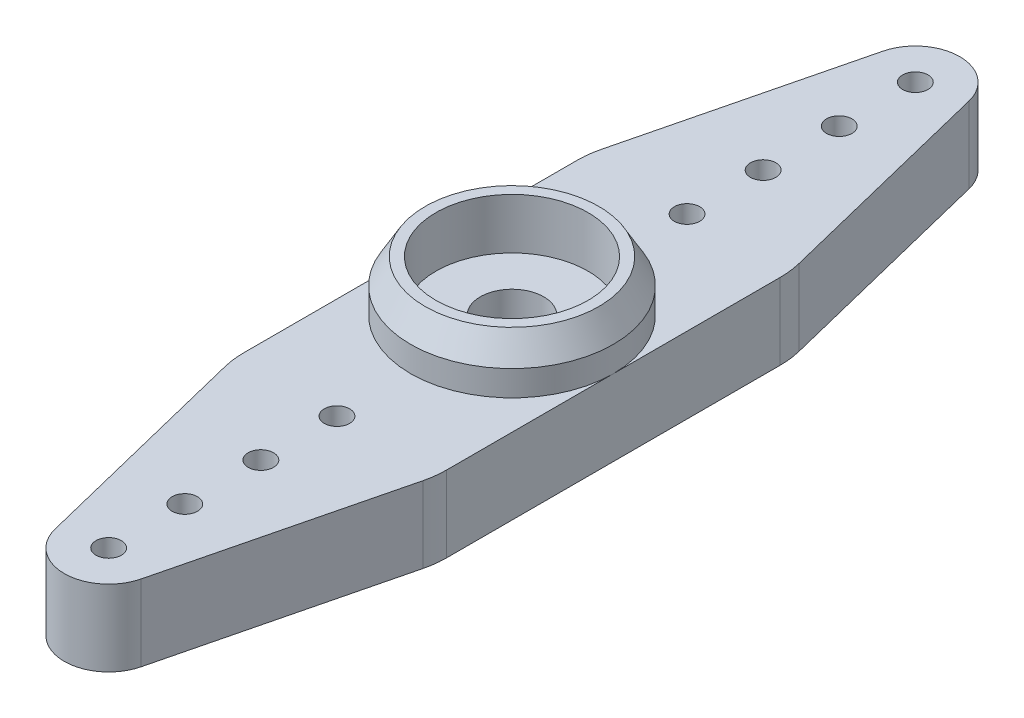
from build123d import *

# Parameters (mm, degrees)
CROQUIS1_R              = 0.5
SALIENTE_EXTRUIR1_DEPTH = 3
MATRIZC1_COUNT          = 2
CROQUIS2_R              = 4
CROQUIS2_R_2            = 3
SALIENTE_EXTRUIR2_DEPTH = 2
CHAFL_N1_SIZE           = 1
CHAFL_N1_SIZE2          = 0.577350269


with BuildPart() as part:
    # Croquis1 → Saliente-Extruir1 (new body)
    with BuildSketch(Plane(origin=(0, 0, 0), x_dir=(1, 0, 0), z_dir=(0, 1, 0))):
        with BuildLine():
            Line((-4, 0), (-4, 6.574293681))
            ThreePointArc((-4, 6.574293681), (-3.974394349, 6.996885575), (-3.897952052, 7.413294188))
            Line((-3.897952052, 7.413294188), (-1.698976026, 16.319147094))
            ThreePointArc((-1.698976026, 16.319147094), (0, 17.649646841), (1.698976026, 16.319147094))
            Line((1.698976026, 16.319147094), (3.897952052, 7.413294188))
            ThreePointArc((3.897952052, 7.413294188), (3.974394349, 6.996885575), (4, 6.574293681))
            Line((4, 6.574293681), (4, 0))
            Line((4, 0), (1.25, 0))
            ThreePointArc((1.25, 0), (0, 1.25), (-1.25, 0))
            Line((-1.25, 0), (-4, 0))
        make_face()
        with Locations(Location((0, 15.899646841, 0), (0, 0, 270))):
            Circle(CROQUIS1_R, mode=Mode.SUBTRACT)
        with Locations(Location((0, 12.899646841, 0), (0, 0, 270))):
            Circle(CROQUIS1_R, mode=Mode.SUBTRACT)
        with Locations(Location((0, 9.899646841, 0), (0, 0, 270))):
            Circle(CROQUIS1_R, mode=Mode.SUBTRACT)
        with Locations(Location((0, 6.899646841, 0), (0, 0, 270))):
            Circle(CROQUIS1_R, mode=Mode.SUBTRACT)
    saliente_extruir1 = extrude(amount=SALIENTE_EXTRUIR1_DEPTH)

    # MatrizC1: Saliente-Extruir1 ×2 about axis
    matrizc1_axis = Axis((0, 0, 0), (0, 1, 0))
    for i in range(1, MATRIZC1_COUNT):
        add(saliente_extruir1.rotate(matrizc1_axis, i * 360 / MATRIZC1_COUNT))

    # Croquis2 → Saliente-Extruir2 (add)
    with BuildSketch(Plane(origin=(0, 3, 0), x_dir=(1, 0, 0), z_dir=(0, 1, 0))):
        with Locations(Location((0, 0, 0), (0, 0, 180))):
            Circle(CROQUIS2_R)
        with Locations(Location((0, 0, 0), (0, 0, 270))):
            Circle(CROQUIS2_R_2, mode=Mode.SUBTRACT)
    extrude(amount=SALIENTE_EXTRUIR2_DEPTH)

    # Chaflán1
    chafl_n1_edges = [part.edges().sort_by_distance(p)[0] for p in [
        (4, 5, 0),
    ]]
    chafl_n1_side = [part.faces().sort_by_distance(p)[0] for p in [
        (4, 4, 0),
    ]]
    chamfer(chafl_n1_edges, length=CHAFL_N1_SIZE, length2=CHAFL_N1_SIZE2, reference=chafl_n1_side[0])


solid = part.part
